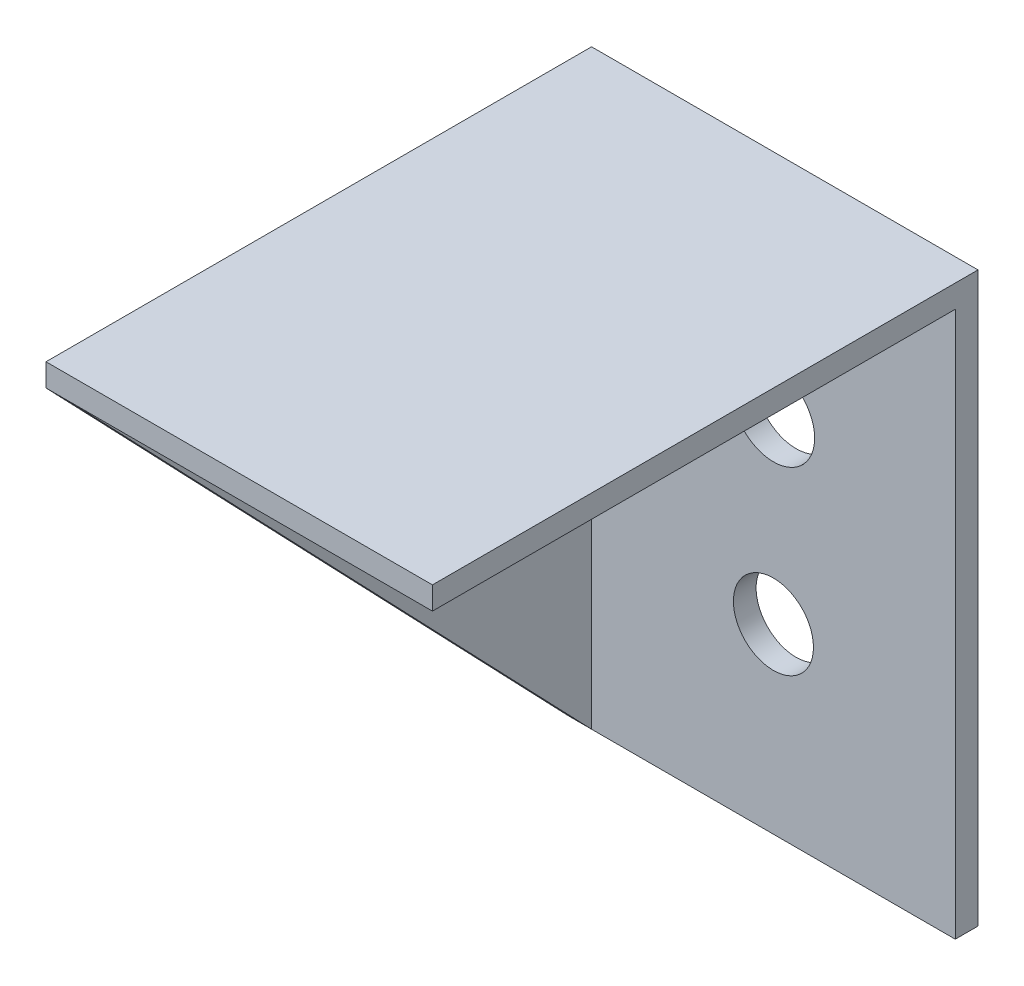
from build123d import *

# Parameters (mm, degrees)
SKETCH_1_W          = 2
SKETCH_1_H          = 3
EXTRUDE_1_DEPTH     = 0.125
SKETCH_2_W          = 2
SKETCH_2_H          = 3
EXTRUDE_2_DEPTH     = 0.125
EXTRUDE_3_DEPTH     = 0.125
SKETCH_4_R          = 0.22010833
SKETCH_4_R_2        = 0.226682005
CUT_EXTRUDE_1_DEPTH = 5.635816039


with BuildPart() as part:
    # 草图1 → 凸台-拉伸1 (new body)
    with BuildSketch(Plane.XY):
        with Locations((-0.853146853, 1.426573427)):
            Rectangle(SKETCH_1_W, SKETCH_1_H)
    extrude(amount=EXTRUDE_1_DEPTH)

    # 草图2 → 凸台-拉伸2 (add)
    with BuildSketch(Plane(origin=(0, 2.926573427, 0), x_dir=(1, 0, 0), z_dir=(0, 1, 0))):
        with Locations((-0.853146853, -1.5)):
            Rectangle(SKETCH_2_W, SKETCH_2_H)
    extrude(amount=EXTRUDE_2_DEPTH)

    # 草图3 → 凸台-拉伸3 (add)
    with BuildSketch(Plane.ZY.offset(1.853146853)):
        Polygon((0, 3.051573427), (0, -0.073426573), (0.125, -0.073426573), (3, 2.926573427), (3, 3.051573427), align=None)
    extrude(amount=EXTRUDE_3_DEPTH)

    # 草图4 → 切除-拉伸1 (cut, through all)
    with BuildSketch(Plane.XY.offset(0.125)):
        with Locations((-0.853146853, 0.926573427)):
            Circle(SKETCH_4_R)
        with Locations((-0.853146853, 1.926573427)):
            Circle(SKETCH_4_R_2)
    extrude(amount=-CUT_EXTRUDE_1_DEPTH, mode=Mode.SUBTRACT)


solid = part.part
